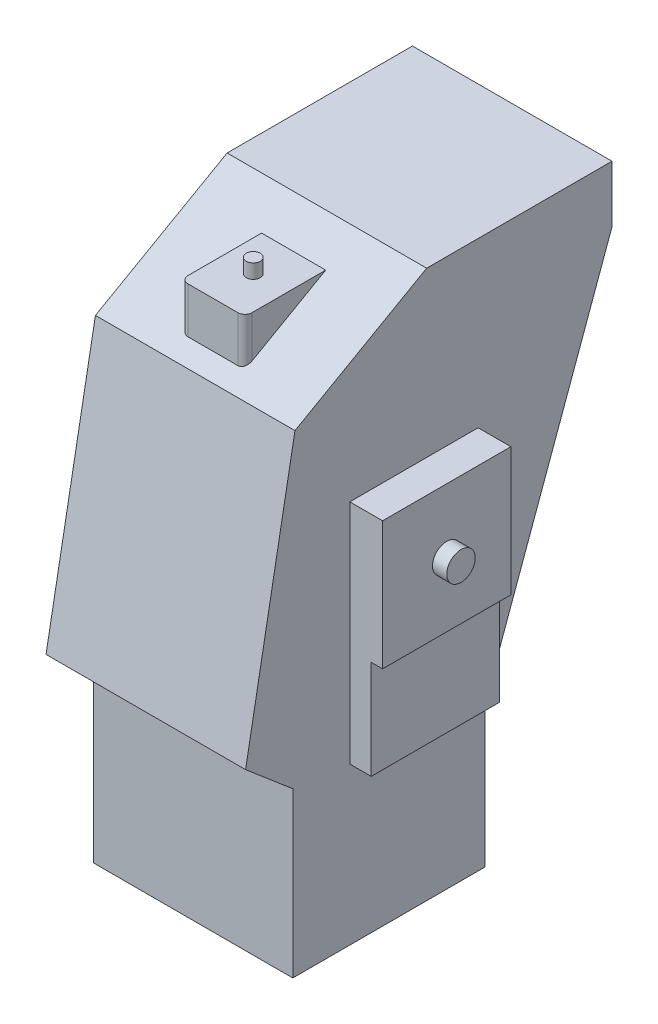
from build123d import *

# Parameters (mm, degrees)
BOSS_EXTRUDE1_DEPTH = 140
BOSS_EXTRUDE2_REACH = 428.071
SKETCH2_W           = 45
SKETCH2_H           = 60
FILLET3_R           = 5
SKETCH3_R           = 4.9
BOSS_EXTRUDE3_DEPTH = 10
SKETCH5_W           = 90
SKETCH5_H           = 159.320081404
BOSS_EXTRUDE4_DEPTH = 15
SKETCH6_W           = 90
SKETCH6_H           = 90
BOSS_EXTRUDE5_DEPTH = 8
SKETCH7_R           = 10
BOSS_EXTRUDE6_DEPTH = 10


with BuildPart() as part:
    # Sketch1 → Boss-Extrude1 (new body)
    with BuildSketch(Plane(origin=(0, 0, 0), x_dir=(0, 0, -1), z_dir=(1, 0, 0))):
        Polygon((-28.65072374, 264.999954135), (101.34927626, 264.999954135), (101.34927626, 224.999954135), (12.424038995, -19.320127269), (12.424038995, -119.320127269), (-122.575961005, -119.320127269), (-122.575961005, -4.320127269), (-155.703127425, 23.841926011), (-121.056779311, 212.517254187), align=None)
    extrude(amount=-BOSS_EXTRUDE1_DEPTH)

    # Boss-Extrude2: up to this face of the body (flat: up to its plane)
    boss_extrude2_end = Plane(part.part.faces().sort_by_distance((-70, 238.758604161, 74.853751525))[0])
    # Sketch2 → Boss-Extrude2 (add, up to the picked face)
    with BuildSketch(Plane(origin=(0, 251.749954135, 0), x_dir=(1, 0, 0), z_dir=(0, 1, 0)), mode=Mode.PRIVATE) as boss_extrude2_sk1:
        with Locations((-70, -78.65072374)):
            Rectangle(SKETCH2_W, SKETCH2_H)
    boss_extrude2_tool1 = split(extrude(boss_extrude2_sk1.sketch, amount=-BOSS_EXTRUDE2_REACH, mode=Mode.PRIVATE), bisect_by=boss_extrude2_end, keep=Keep.BOTH, mode=Mode.PRIVATE)
    add(boss_extrude2_tool1.solids().sort_by(Axis((-70, 251.749954, 78.650724), (0, -1, 0)))[0])

    # Fillet3
    fillet3_edges = [part.edges().sort_by_distance(p)[0] for p in [
        (-47.5, 235.656659485, 108.65072374),
        (-92.5, 235.656659485, 108.65072374),
    ]]
    fillet(fillet3_edges, radius=FILLET3_R)

    # Sketch3 → Boss-Extrude3 (add)
    with BuildSketch(Plane(origin=(0, 251.749954135, 0), x_dir=(1, 0, 0), z_dir=(0, 1, 0))):
        with Locations(Location((-70.732233047, -79.583098626, 0), (0, 0, 270))):
            Circle(SKETCH3_R)
    extrude(amount=BOSS_EXTRUDE3_DEPTH)

    # Sketch5 → Boss-Extrude4 (add)
    with BuildSketch(Plane(origin=(0, 0, 0), x_dir=(0, 0, -1), z_dir=(1, 0, 0))):
        with Locations((-37.575961005, 70.339913433)):
            Rectangle(SKETCH5_W, SKETCH5_H)
    boss_extrude4 = extrude(amount=BOSS_EXTRUDE4_DEPTH)

    # Sketch6 → Boss-Extrude5 (add)
    with BuildSketch(Plane(origin=(15, 0, 0), x_dir=(0, 0, -1), z_dir=(1, 0, 0))):
        with Locations((-37.575961005, 104.999954135)):
            Rectangle(SKETCH6_W, SKETCH6_H)
    boss_extrude5 = extrude(amount=BOSS_EXTRUDE5_DEPTH)

    # Sketch7 → Boss-Extrude6 (add)
    with BuildSketch(Plane(origin=(23, 0, 0), x_dir=(0, 0, -1), z_dir=(1, 0, 0))):
        with Locations((-37.575961005, 104.999954135)):
            Circle(SKETCH7_R)
    boss_extrude6 = extrude(amount=BOSS_EXTRUDE6_DEPTH)

    # Mirror1: Boss-Extrude4, Boss-Extrude5, Boss-Extrude6 across plane
    add(boss_extrude4.mirror(Plane(origin=(-70, 0, 0), x_dir=(0, 0, 1), z_dir=(1, 0, 0))))
    add(boss_extrude5.mirror(Plane(origin=(-70, 0, 0), x_dir=(0, 0, 1), z_dir=(1, 0, 0))))
    add(boss_extrude6.mirror(Plane(origin=(-70, 0, 0), x_dir=(0, 0, 1), z_dir=(1, 0, 0))))


solid = part.part
